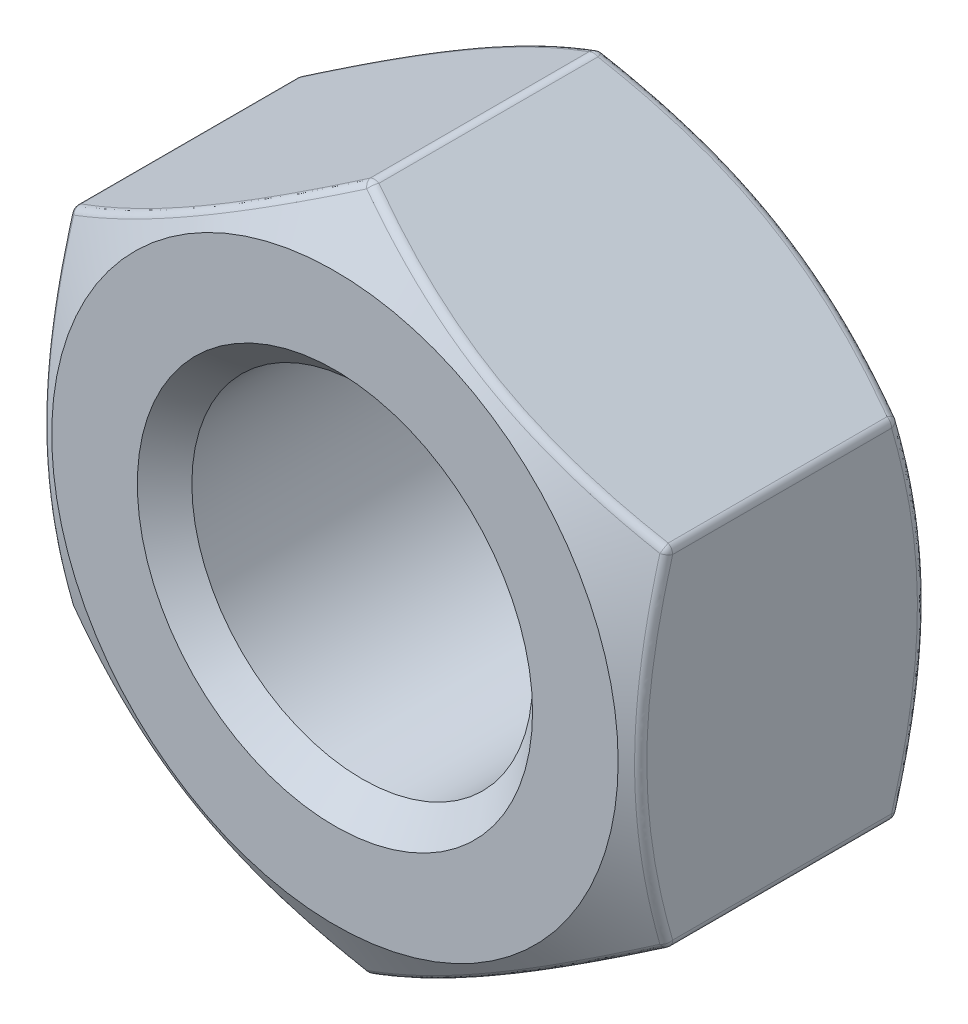
from build123d import *

# Parameters (mm, degrees)
SKETCH3_R           = 3.175
BOSS_EXTRUDE1_DEPTH = 2.778125
SKETCH4_OUTSIDE_W   = 55.29
SKETCH4_OUTSIDE_H   = 57.01
SKETCH4_OUTSIDE_R   = 5.2784375
CUT_EXTRUDE1_DEPTH  = 11.1442782
CUT_EXTRUDE1_DRAFT  = -60
CUT_EXTRUDE2_START  = -5.55625
SKETCH4_2_OUTSIDE_W = 74.536
SKETCH4_2_OUTSIDE_H = 76.256
SKETCH4_2_OUTSIDE_R = 5.2784375
CUT_EXTRUDE2_DEPTH  = 16.7005282
CUT_EXTRUDE2_DRAFT  = 60
FILLET1_R           = 0.1666875
CHAMFER1_SIZE       = 0.508


with BuildPart() as part:
    # Sketch3 → Boss-Extrude1 (new, symmetric)
    with BuildSketch(Plane.XY):
        Polygon((0, 6.415804866), (-5.55625, 3.207902433), (-5.55625, -3.207902433), (0, -6.415804866), (5.55625, -3.207902433), (5.55625, 3.207902433), align=None)
        Circle(SKETCH3_R, mode=Mode.SUBTRACT)
    extrude(amount=BOSS_EXTRUDE1_DEPTH, both=True)


with BuildPart() as cut_extrude1_tool:
    # Sketch4 outside → Cut-Extrude1 (with draft: the straight prism first)
    with BuildSketch(Plane.XY.offset(2.778125)):
        Rectangle(SKETCH4_OUTSIDE_W, SKETCH4_OUTSIDE_H)
        Circle(SKETCH4_OUTSIDE_R, mode=Mode.SUBTRACT)
    extrude(amount=-CUT_EXTRUDE1_DEPTH)
    # Cut-Extrude1: the draft: its side faces are tilted about the plane it starts from
    cut_extrude1_sides = [cut_extrude1_tool.faces().sort_by_distance(p)[0] for p in [
        (0, -28.505, -2.7940141),
        (27.645, 0, -2.7940141),
        (0, 28.505, -2.7940141),
        (-27.645, 0, -2.7940141),
        (-5.2784375, 0, -2.7940141),
    ]]
    draft(cut_extrude1_sides, Plane.XY.offset(2.778125), CUT_EXTRUDE1_DRAFT)


with BuildPart() as part_1:
    add(part.part)

    # Cut-Extrude1: cut by cut_extrude1_tool
    add(cut_extrude1_tool.part, mode=Mode.SUBTRACT)


with BuildPart() as cut_extrude2_tool:
    # Sketch4<2> outside → Cut-Extrude2 (with draft: the straight prism first)
    with BuildSketch(Plane.XY.offset(2.778125).offset(CUT_EXTRUDE2_START)):
        Rectangle(SKETCH4_2_OUTSIDE_W, SKETCH4_2_OUTSIDE_H)
        Circle(SKETCH4_2_OUTSIDE_R, mode=Mode.SUBTRACT)
    extrude(amount=CUT_EXTRUDE2_DEPTH)
    # Cut-Extrude2: the draft: its side faces are tilted about the plane it starts from
    cut_extrude2_sides = [cut_extrude2_tool.faces().sort_by_distance(p)[0] for p in [
        (0, -38.128, 5.5721391),
        (37.268, 0, 5.5721391),
        (0, 38.128, 5.5721391),
        (-37.268, 0, 5.5721391),
        (-5.2784375, 0, 5.5721391),
    ]]
    draft(cut_extrude2_sides, Plane.XY.offset(2.778125).offset(CUT_EXTRUDE2_START), CUT_EXTRUDE2_DRAFT)


with BuildPart() as part_2:
    add(part_1.part)

    # Cut-Extrude2: cut by cut_extrude2_tool
    add(cut_extrude2_tool.part, mode=Mode.SUBTRACT)

    # Fillet1
    fillet1_edges = [part_2.edges().sort_by_distance(p)[0] for p in [
        (5.55625, 3.207902433, 0),
        (5.55625, -3.207902433, 0),
        (5.55625, -1.621252068, 2.483957466),
        (0, -6.415804866, 0),
        (-5.55625, -3.207902433, 0),
        (-5.55625, 3.207902433, 0),
        (0, 6.415804866, 0),
        (2.778125, 4.81185365, 2.617729878),
        (-2.778125, 4.81185365, 2.617729878),
        (-5.55625, 0, 2.617729878),
        (-2.778125, -4.81185365, 2.617729878),
        (2.778125, -4.81185365, 2.617729878),
        (5.55625, -1.621252068, -2.483957466),
        (2.778125, 4.81185365, -2.617729878),
        (-2.778125, 4.81185365, -2.617729878),
        (-5.55625, 0, -2.617729878),
        (-2.778125, -4.81185365, -2.617729878),
        (2.778125, -4.81185365, -2.617729878),
    ]]
    fillet(fillet1_edges, radius=FILLET1_R)

    # Chamfer1
    chamfer1_edges = [part_2.edges().sort_by_distance(p)[0] for p in [
        (-3.175, 0, -2.778125),
        (-3.175, 0, 2.778125),
    ]]
    chamfer(chamfer1_edges, length=CHAMFER1_SIZE)


solid = part_2.part
